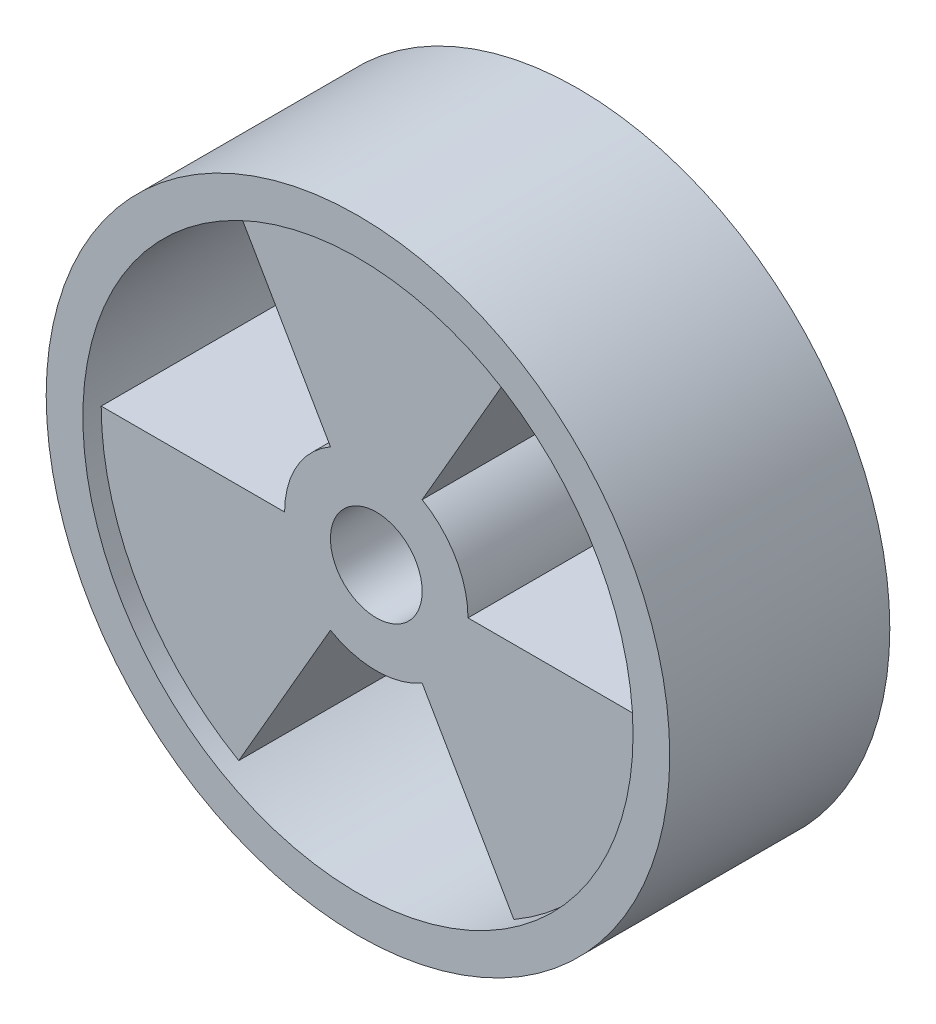
from build123d import *
from build123d.topology import SkipClean

# Parameters (mm, degrees)
SKETCH1_R                = 17
BOSS_EXTRUDE1_DEPTH      = 10
CUT_EXTRUDE2_REACH       = 28.038
BOSS_EXTRUDE2_DEPTH      = 11
BOSS_EXTRUDE2_DEPTH_BACK = 1
SKETCH1_6_R              = 17
CUT_EXTRUDE3_REACH       = 28.439
SKETCH1_7_R              = 2.5


with BuildPart() as part:
    # Sketch1 → Boss-Extrude1 (new body)
    with BuildSketch(Plane.XY):
        Circle(SKETCH1_R)
    extrude(amount=BOSS_EXTRUDE1_DEPTH)

    # Sketch1<5> → Cut-Extrude2 (cut, up to next)
    with BuildSketch(Plane.XY, mode=Mode.PRIVATE) as cut_extrude2_sk1:
        with BuildLine():
            Line((7.5, 12.990381057), (2.5, 4.330127019))
            ThreePointArc((2.5, 4.330127019), (4.330127019, 2.5), (5, 0))
            Line((5, 0), (15, 0))
            ThreePointArc((15, 0), (12.990381057, 7.5), (7.5, 12.990381057))
        make_face()
    cut_extrude2_tool1 = extrude(cut_extrude2_sk1.sketch, amount=CUT_EXTRUDE2_REACH, mode=Mode.PRIVATE) & part.part
    # Sketch1<5> → Cut-Extrude2 (cut, up to next)
    with BuildSketch(Plane.XY, mode=Mode.PRIVATE) as cut_extrude2_sk2:
        with BuildLine():
            ThreePointArc((-5, 0), (-4.330127019, 2.5), (-2.5, 4.330127019))
            Line((-2.5, 4.330127019), (-7.5, 12.990381057))
            ThreePointArc((-7.5, 12.990381057), (-12.990381057, 7.5), (-15, 0))
            Line((-15, 0), (-5, 0))
        make_face()
    cut_extrude2_tool2 = extrude(cut_extrude2_sk2.sketch, amount=CUT_EXTRUDE2_REACH, mode=Mode.PRIVATE) & part.part
    # Sketch1<5> → Cut-Extrude2 (cut, up to next)
    with BuildSketch(Plane.XY, mode=Mode.PRIVATE) as cut_extrude2_sk3:
        with BuildLine():
            Line((7.5, -12.990381057), (2.5, -4.330127019))
            ThreePointArc((2.5, -4.330127019), (0, -5), (-2.5, -4.330127019))
            Line((-2.5, -4.330127019), (-7.5, -12.990381057))
            ThreePointArc((-7.5, -12.990381057), (0, -15), (7.5, -12.990381057))
        make_face()
    cut_extrude2_tool3 = extrude(cut_extrude2_sk3.sketch, amount=CUT_EXTRUDE2_REACH, mode=Mode.PRIVATE) & part.part
    add(cut_extrude2_tool1.solids().sort_by_distance((8.959095, 5.172536, 0))[0], mode=Mode.SUBTRACT)
    add(cut_extrude2_tool2.solids().sort_by_distance((-8.959095, 5.172536, 0))[0], mode=Mode.SUBTRACT)
    add(cut_extrude2_tool3.solids().sort_by_distance((0, -10.345071, 0))[0], mode=Mode.SUBTRACT)

    # Sketch1<6> → Boss-Extrude2 (add, two sides: drawn at the far end of the back side and taken through both)
    with SkipClean():  # the faces are left unmerged after this step: merging them gives an invalid solid
        with BuildSketch(Plane.XY.offset(-BOSS_EXTRUDE2_DEPTH_BACK)):
            Circle(SKETCH1_6_R)
            with BuildLine():
                ThreePointArc((-7.5, 12.990381057), (0, 15), (7.5, 12.990381057))
                ThreePointArc((7.5, 12.990381057), (12.990381057, 7.5), (15, 0))
                ThreePointArc((15, 0), (12.990381057, -7.5), (7.5, -12.990381057))
                ThreePointArc((7.5, -12.990381057), (0, -15), (-7.5, -12.990381057))
                ThreePointArc((-7.5, -12.990381057), (-12.990381057, -7.5), (-15, 0))
                ThreePointArc((-15, 0), (-12.990381057, 7.5), (-7.5, 12.990381057))
            make_face(mode=Mode.SUBTRACT)
        extrude(amount=BOSS_EXTRUDE2_DEPTH + BOSS_EXTRUDE2_DEPTH_BACK)

    # Sketch1<7> → Cut-Extrude3 (cut, up to next)
    with BuildSketch(Plane.XY, mode=Mode.PRIVATE) as cut_extrude3_sk1:
        Circle(SKETCH1_7_R)
    cut_extrude3_tool1 = extrude(cut_extrude3_sk1.sketch, amount=CUT_EXTRUDE3_REACH, mode=Mode.PRIVATE) & part.part
    add(cut_extrude3_tool1.solids().sort_by_distance((0, 0, 0))[0], mode=Mode.SUBTRACT)


solid = part.part
